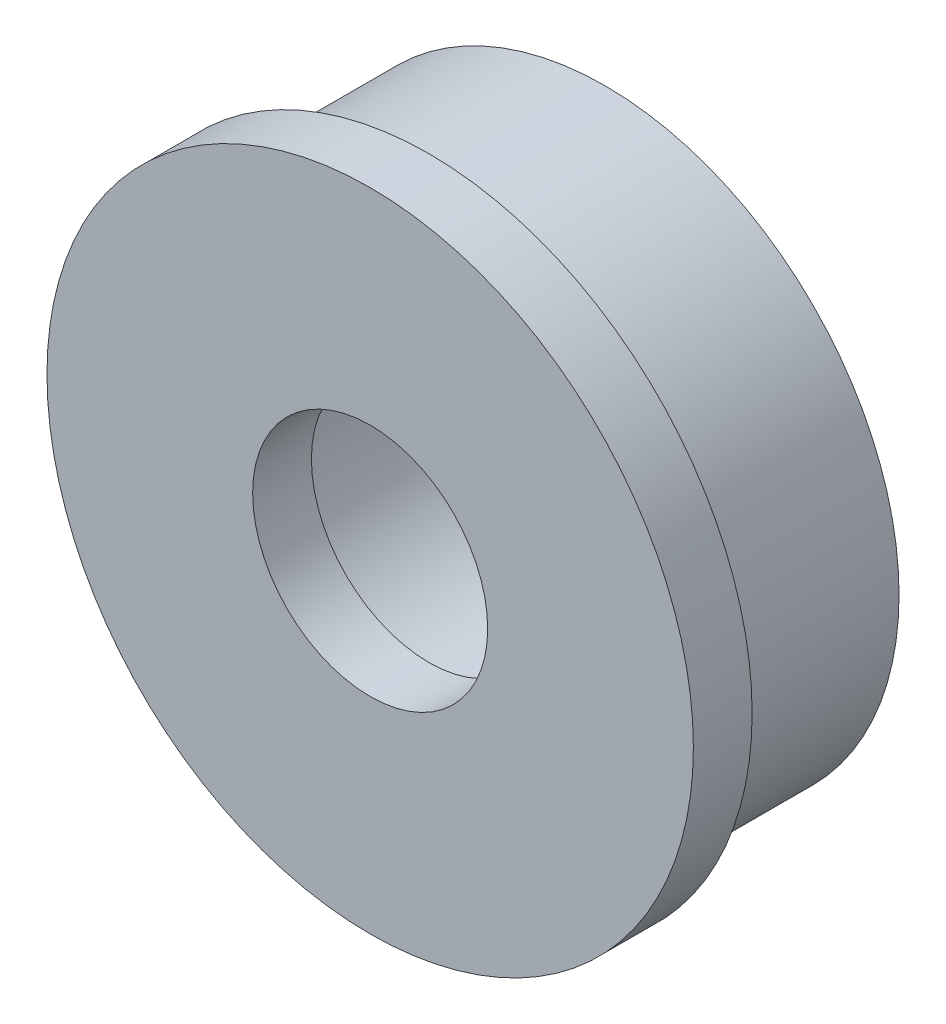
from build123d import *

# Parameters (mm, degrees)
SKETCH_1_R      = 5
SKETCH_1_R_2    = 2.5
EXTRUDE_1_DEPTH = 3
SKETCH_2_R      = 5.5
SKETCH_2_R_2    = 2
EXTRUDE_2_DEPTH = 1


with BuildPart() as part:
    # 草图1 → 凸台-拉伸1 (new body)
    with BuildSketch(Plane.XY):
        Circle(SKETCH_1_R)
        Circle(SKETCH_1_R_2, mode=Mode.SUBTRACT)
    extrude(amount=EXTRUDE_1_DEPTH)

    # 草图2 → 凸台-拉伸2 (add)
    with BuildSketch(Plane.XY.offset(3)):
        Circle(SKETCH_2_R)
        Circle(SKETCH_2_R_2, mode=Mode.SUBTRACT)
    extrude(amount=EXTRUDE_2_DEPTH)


solid = part.part
